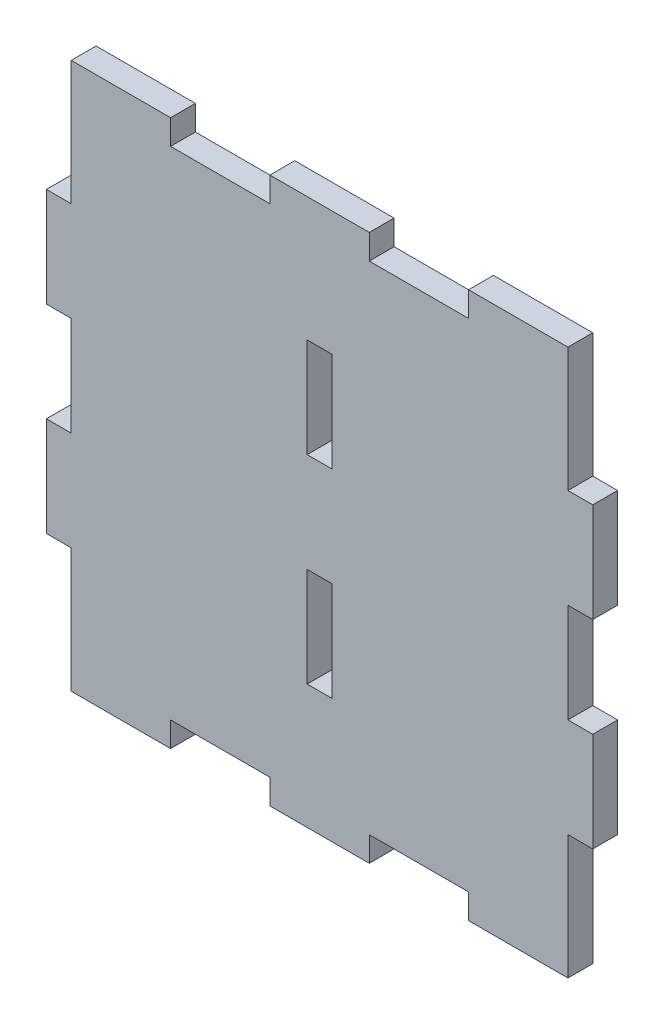
from build123d import *

# Parameters (mm, degrees)
ESBO_O1_W                = 3
ESBO_O1_H                = 12
RESSALTO_EXTRUS_O1_DEPTH = 3


with BuildPart() as part:
    # Esboço1 → Ressalto-extrusão1 (new body)
    with BuildSketch(Plane.XY):
        Polygon((-31.216896784, 9.909791424), (-31.216896784, -2.090208576), (-34.216896784, -2.090208576), (-34.216896784, -14.090208576), (-31.216896784, -14.090208576), (-31.216896784, -26.090208576), (-31.216896784, -29.090208576), (-19.216896784, -29.090208576), (-19.216896784, -26.090208576), (-7.216896784, -26.090208576), (-7.216896784, -29.090208576), (4.783103216, -29.090208576), (4.783103216, -26.090208576), (16.783103216, -26.090208576), (16.783103216, -29.090208576), (28.783103216, -29.090208576), (28.783103216, -26.090208576), (28.783103216, -14.090208576), (31.783103216, -14.090208576), (31.783103216, -2.090208576), (28.783103216, -2.090208576), (28.783103216, 9.909791424), (31.783103216, 9.909791424), (31.783103216, 21.909791424), (28.783103216, 21.909791424), (28.783103216, 33.909791424), (28.783103216, 36.909791424), (16.783103216, 36.909791424), (16.783103216, 33.909791424), (4.783103216, 33.909791424), (4.783103216, 36.909791424), (-7.216896784, 36.909791424), (-7.216896784, 33.909791424), (-19.216896784, 33.909791424), (-19.216896784, 36.909791424), (-31.216896784, 36.909791424), (-31.216896784, 33.909791424), (-31.216896784, 21.909791424), (-34.216896784, 21.909791424), (-34.216896784, 9.909791424), align=None)
        with Locations((-1.216896784, -8.090208576)):
            Rectangle(ESBO_O1_W, ESBO_O1_H, mode=Mode.SUBTRACT)
        with Locations((-1.216896784, 15.909791424)):
            Rectangle(ESBO_O1_W, ESBO_O1_H, mode=Mode.SUBTRACT)
    extrude(amount=RESSALTO_EXTRUS_O1_DEPTH)


solid = part.part
